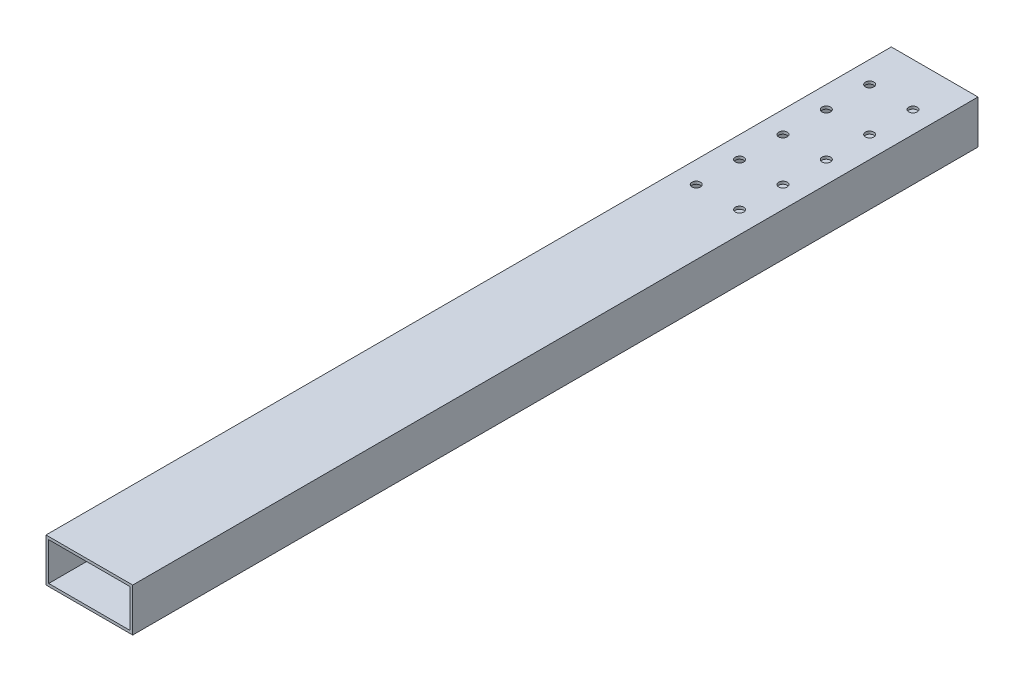
from build123d import *

# Parameters (mm, degrees)
SKETCH1_W           = 50.8
SKETCH1_H           = 25.4
BOSS_EXTRUDE1_DEPTH = 495.3
SHELL1_T            = -1.5875
CUT_EXTRUDE1_REACH  = 498.601
SKETCH2_R           = 2.4892


with BuildPart() as part:
    # Sketch1 → Boss-Extrude1 (new body)
    with BuildSketch(Plane.XY):
        Rectangle(SKETCH1_W, SKETCH1_H)
    extrude(amount=BOSS_EXTRUDE1_DEPTH)

    # Shell1
    shell1_openings = [part.faces().sort_by_distance(p)[0] for p in [
        (0, 0, 495.3),
        (0, 0, 0),
    ]]
    offset(amount=SHELL1_T, openings=shell1_openings, kind=Kind.INTERSECTION)

    # Sketch2 → Cut-Extrude1 (cut, up to next)
    with BuildSketch(Plane(origin=(0, 12.7, 0), x_dir=(1, 0, 0), z_dir=(0, 1, 0)), mode=Mode.PRIVATE) as cut_extrude1_sk1:
        with Locations(Location((-12.7, -25.4, 0), (0, 0, 270))):
            Circle(SKETCH2_R)
    cut_extrude1_tool1 = extrude(cut_extrude1_sk1.sketch, amount=-CUT_EXTRUDE1_REACH, mode=Mode.PRIVATE) & part.part
    # Sketch2 → Cut-Extrude1 (cut, up to next)
    with BuildSketch(Plane(origin=(0, 12.7, 0), x_dir=(1, 0, 0), z_dir=(0, 1, 0)), mode=Mode.PRIVATE) as cut_extrude1_sk2:
        with Locations(Location((12.7, -25.4, 0), (0, 0, 270))):
            Circle(SKETCH2_R)
    cut_extrude1_tool2 = extrude(cut_extrude1_sk2.sketch, amount=-CUT_EXTRUDE1_REACH, mode=Mode.PRIVATE) & part.part
    # Sketch2 → Cut-Extrude1 (cut, up to next)
    with BuildSketch(Plane(origin=(0, 12.7, 0), x_dir=(1, 0, 0), z_dir=(0, 1, 0)), mode=Mode.PRIVATE) as cut_extrude1_sk3:
        with Locations(Location((12.7, -50.8, 0), (0, 0, 270))):
            Circle(SKETCH2_R)
    cut_extrude1_tool3 = extrude(cut_extrude1_sk3.sketch, amount=-CUT_EXTRUDE1_REACH, mode=Mode.PRIVATE) & part.part
    # Sketch2 → Cut-Extrude1 (cut, up to next)
    with BuildSketch(Plane(origin=(0, 12.7, 0), x_dir=(1, 0, 0), z_dir=(0, 1, 0)), mode=Mode.PRIVATE) as cut_extrude1_sk4:
        with Locations(Location((12.7, -76.2, 0), (0, 0, 270))):
            Circle(SKETCH2_R)
    cut_extrude1_tool4 = extrude(cut_extrude1_sk4.sketch, amount=-CUT_EXTRUDE1_REACH, mode=Mode.PRIVATE) & part.part
    # Sketch2 → Cut-Extrude1 (cut, up to next)
    with BuildSketch(Plane(origin=(0, 12.7, 0), x_dir=(1, 0, 0), z_dir=(0, 1, 0)), mode=Mode.PRIVATE) as cut_extrude1_sk5:
        with Locations(Location((12.7, -101.6, 0), (0, 0, 270))):
            Circle(SKETCH2_R)
    cut_extrude1_tool5 = extrude(cut_extrude1_sk5.sketch, amount=-CUT_EXTRUDE1_REACH, mode=Mode.PRIVATE) & part.part
    # Sketch2 → Cut-Extrude1 (cut, up to next)
    with BuildSketch(Plane(origin=(0, 12.7, 0), x_dir=(1, 0, 0), z_dir=(0, 1, 0)), mode=Mode.PRIVATE) as cut_extrude1_sk6:
        with Locations(Location((12.7, -127, 0), (0, 0, 270))):
            Circle(SKETCH2_R)
    cut_extrude1_tool6 = extrude(cut_extrude1_sk6.sketch, amount=-CUT_EXTRUDE1_REACH, mode=Mode.PRIVATE) & part.part
    # Sketch2 → Cut-Extrude1 (cut, up to next)
    with BuildSketch(Plane(origin=(0, 12.7, 0), x_dir=(1, 0, 0), z_dir=(0, 1, 0)), mode=Mode.PRIVATE) as cut_extrude1_sk7:
        with Locations(Location((-12.7, -50.8, 0), (0, 0, 270))):
            Circle(SKETCH2_R)
    cut_extrude1_tool7 = extrude(cut_extrude1_sk7.sketch, amount=-CUT_EXTRUDE1_REACH, mode=Mode.PRIVATE) & part.part
    # Sketch2 → Cut-Extrude1 (cut, up to next)
    with BuildSketch(Plane(origin=(0, 12.7, 0), x_dir=(1, 0, 0), z_dir=(0, 1, 0)), mode=Mode.PRIVATE) as cut_extrude1_sk8:
        with Locations(Location((-12.7, -76.2, 0), (0, 0, 270))):
            Circle(SKETCH2_R)
    cut_extrude1_tool8 = extrude(cut_extrude1_sk8.sketch, amount=-CUT_EXTRUDE1_REACH, mode=Mode.PRIVATE) & part.part
    # Sketch2 → Cut-Extrude1 (cut, up to next)
    with BuildSketch(Plane(origin=(0, 12.7, 0), x_dir=(1, 0, 0), z_dir=(0, 1, 0)), mode=Mode.PRIVATE) as cut_extrude1_sk9:
        with Locations(Location((-12.7, -101.6, 0), (0, 0, 270))):
            Circle(SKETCH2_R)
    cut_extrude1_tool9 = extrude(cut_extrude1_sk9.sketch, amount=-CUT_EXTRUDE1_REACH, mode=Mode.PRIVATE) & part.part
    # Sketch2 → Cut-Extrude1 (cut, up to next)
    with BuildSketch(Plane(origin=(0, 12.7, 0), x_dir=(1, 0, 0), z_dir=(0, 1, 0)), mode=Mode.PRIVATE) as cut_extrude1_sk10:
        with Locations(Location((-12.7, -127, 0), (0, 0, 270))):
            Circle(SKETCH2_R)
    cut_extrude1_tool10 = extrude(cut_extrude1_sk10.sketch, amount=-CUT_EXTRUDE1_REACH, mode=Mode.PRIVATE) & part.part
    add(cut_extrude1_tool1.solids().sort_by_distance((-12.7, 12.7, 25.4))[0], mode=Mode.SUBTRACT)
    add(cut_extrude1_tool2.solids().sort_by_distance((12.7, 12.7, 25.4))[0], mode=Mode.SUBTRACT)
    add(cut_extrude1_tool3.solids().sort_by_distance((12.7, 12.7, 50.8))[0], mode=Mode.SUBTRACT)
    add(cut_extrude1_tool4.solids().sort_by_distance((12.7, 12.7, 76.2))[0], mode=Mode.SUBTRACT)
    add(cut_extrude1_tool5.solids().sort_by_distance((12.7, 12.7, 101.6))[0], mode=Mode.SUBTRACT)
    add(cut_extrude1_tool6.solids().sort_by_distance((12.7, 12.7, 127))[0], mode=Mode.SUBTRACT)
    add(cut_extrude1_tool7.solids().sort_by_distance((-12.7, 12.7, 50.8))[0], mode=Mode.SUBTRACT)
    add(cut_extrude1_tool8.solids().sort_by_distance((-12.7, 12.7, 76.2))[0], mode=Mode.SUBTRACT)
    add(cut_extrude1_tool9.solids().sort_by_distance((-12.7, 12.7, 101.6))[0], mode=Mode.SUBTRACT)
    add(cut_extrude1_tool10.solids().sort_by_distance((-12.7, 12.7, 127))[0], mode=Mode.SUBTRACT)


solid = part.part
